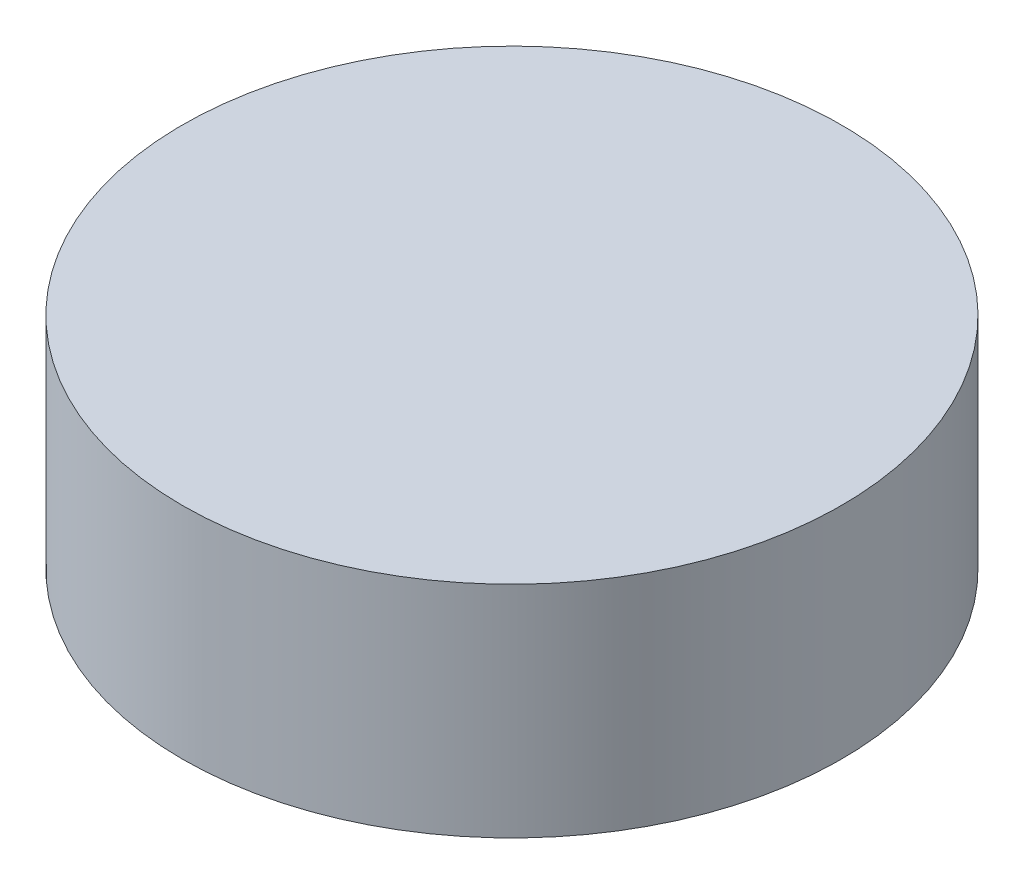
from build123d import *

# Parameters (mm, degrees)
ESQUISSE1_R        = 3
BOSS_EXTRU_1_DEPTH = 2


with BuildPart() as part:
    # Esquisse1 → Boss.-Extru.1 (new body)
    with BuildSketch(Plane(origin=(0, 0, 0), x_dir=(1, 0, 0), z_dir=(0, 1, 0))):
        with Locations(Location((0, 0, 0), (0, 0, 270))):
            Circle(ESQUISSE1_R)
    extrude(amount=BOSS_EXTRU_1_DEPTH)


solid = part.part
